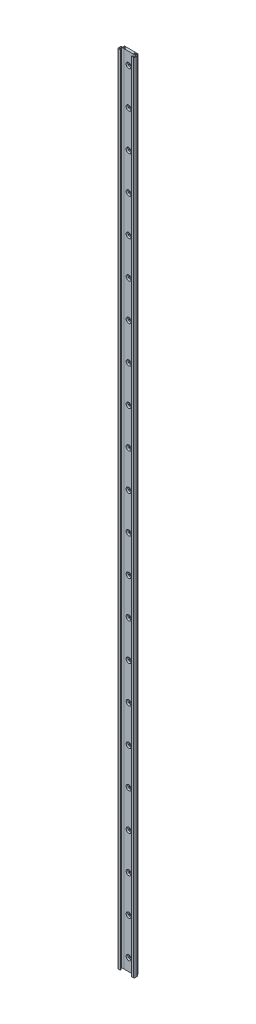
from build123d import *

# Parameters (mm, degrees)
BOSS_EXTRU_1_DEPTH                                 = 1300
ENL_V_MAT_EXTRU_1_DEPTH                            = 1301.099203907
DIAM_TRE_DU_PER_AGE_0_4_0_4_1_D                    = 0.4
CHAMBRAGE_POUR_VIS_T_TE_HEXAGONALE_M41_D           = 4.5
CHAMBRAGE_POUR_VIS_T_TE_HEXAGONALE_M41_CBORE_D     = 8.5
CHAMBRAGE_POUR_VIS_T_TE_HEXAGONALE_M41_CBORE_DEPTH = 3.1
CONG_1_R                                           = 0.2
CONG_2_R                                           = 0.5
CONG_3_R                                           = 1
R_P_TITION_LIN_AIRE1_COUNT                         = 21
R_P_TITION_LIN_AIRE1_PITCH                         = 60


with BuildPart() as part:
    # Esquisse1 → Boss.-Extru.1 (new body)
    with BuildSketch(Plane.XZ):
        with BuildLine():
            Line((13.5, 3), (13.5, 8.7))
            Line((13.5, 8.7), (-13.5, 8.7))
            Line((-13.5, 8.7), (-13.5, 3))
            Line((-13.5, 3), (-7.8, 3))
            ThreePointArc((-7.8, 3), (-7.05, 2.25), (-7.8, 1.5))
            Line((-7.8, 1.5), (-11, 1.5))
            Line((-11, 1.5), (-11, 0))
            Line((-11, 0), (11, 0))
            Line((11, 0), (11, 1.5))
            Line((11, 1.5), (7.8, 1.5))
            ThreePointArc((7.8, 1.5), (7.05, 2.25), (7.8, 3))
            Line((7.8, 3), (13.5, 3))
        make_face()
    extrude(amount=-BOSS_EXTRU_1_DEPTH)

    # Esquisse2 → Enlèv. mat.-Extru.1 (cut, through all)
    with BuildSketch(Plane(origin=(0, 1300, 0), x_dir=(-1, 0, 0), z_dir=(0, 1, 0))):
        Polygon((8.75, 8.7), (-8.75, 8.7), (-8.75, 7.6), (-12, 7.6), (-12, 4.1), (12, 4.1), (12, 7.6), (8.75, 7.6), align=None)
    extrude(amount=-ENL_V_MAT_EXTRU_1_DEPTH, mode=Mode.SUBTRACT)

    # Diamètre du perçage Ø0.4 (0.4)1 (through all)
    with Locations(Plane(origin=(0, 0, 0), x_dir=(-1, 0, 0), z_dir=(0, -1, 0))):
        with Locations((7.75, -4.1), (-7.75, -4.1)):
            Hole(DIAM_TRE_DU_PER_AGE_0_4_0_4_1_D / 2)

    # Chambrage pour vis à tête hexagonale M41 (through all)
    with Locations(Plane.XY.offset(4.1)):
        with Locations((0, 20), (0, 80)):
            chambrage_pour_vis_t_te_hexagonale_m41 = CounterBoreHole(CHAMBRAGE_POUR_VIS_T_TE_HEXAGONALE_M41_D / 2, CHAMBRAGE_POUR_VIS_T_TE_HEXAGONALE_M41_CBORE_D / 2, CHAMBRAGE_POUR_VIS_T_TE_HEXAGONALE_M41_CBORE_DEPTH)

    # Congé1
    cong_1_edges = [part.edges().sort_by_distance(p)[0] for p in [
        (11, 650, 1.5),
        (-11, 650, 1.5),
    ]]
    fillet(cong_1_edges, radius=CONG_1_R)

    # Congé2
    cong_2_edges = [part.edges().sort_by_distance(p)[0] for p in [
        (-12, 650, 7.6),
        (-12, 650, 4.1),
        (12, 650, 4.1),
        (12, 650, 7.6),
    ]]
    fillet(cong_2_edges, radius=CONG_2_R)

    # Congé3
    cong_3_edges = [part.edges().sort_by_distance(p)[0] for p in [
        (-13.5, 650, 3),
        (-13.5, 650, 8.7),
        (13.5, 650, 8.7),
        (13.5, 650, 3),
    ]]
    fillet(cong_3_edges, radius=CONG_3_R)

    # Répétition linéaire1: Chambrage pour vis à tête hexagonale M41 ×21
    with Locations(*[(0, i * R_P_TITION_LIN_AIRE1_PITCH, 0) for i in range(1, R_P_TITION_LIN_AIRE1_COUNT)]):
        add(chambrage_pour_vis_t_te_hexagonale_m41, mode=Mode.SUBTRACT)


solid = part.part
